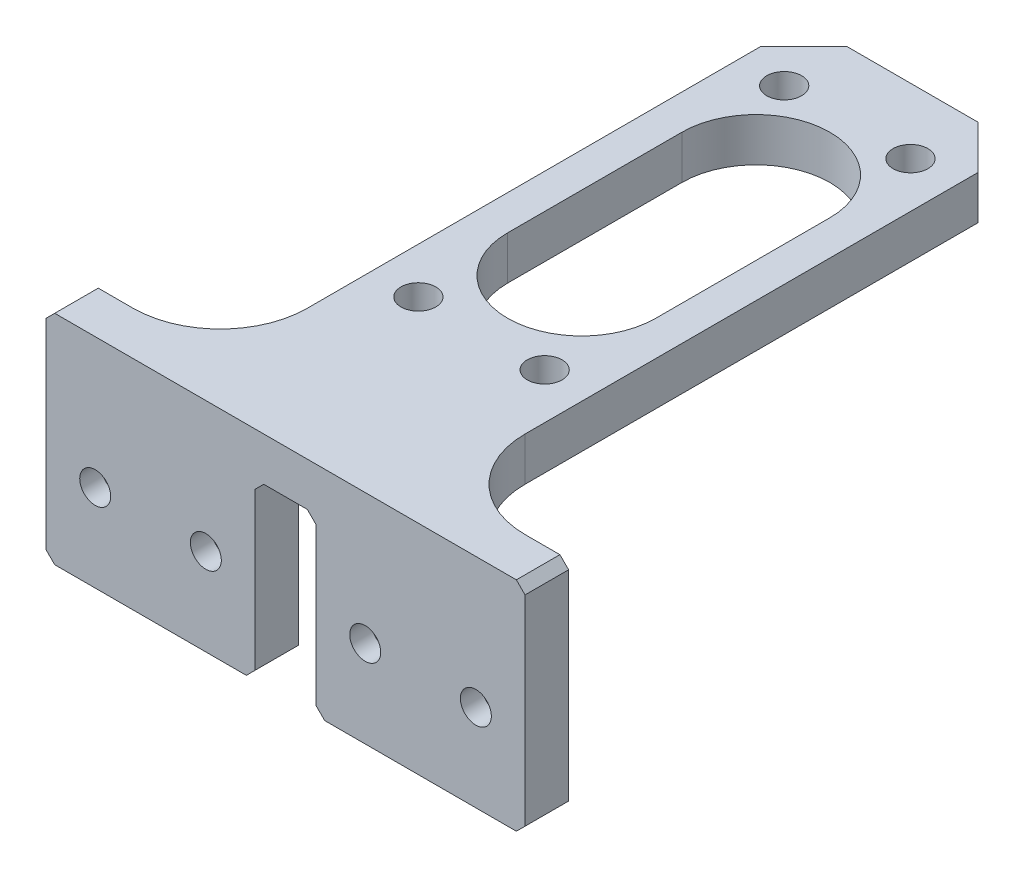
from build123d import *

# Parameters (mm, degrees)
SKETCH1_W           = 25
SKETCH1_H           = 72
SKETCH1_W_2         = 15
SKETCH1_H_2         = 5
BOSS_EXTRUDE1_DEPTH = 5
SKETCH2_R           = 2
CUT_EXTRUDE1_DEPTH  = 46.576858163
CHAMFER1_SIZE       = 5
CUT_EXTRUDE2_DEPTH  = 46.576858163
SKETCH5_W           = 24
SKETCH5_H           = 5
BOSS_EXTRUDE3_DEPTH = 20
FILLET2_R           = 10
CHAMFER3_SIZE       = 1
HOLE1_D             = 3.556
HOLE1_CBORE_D       = 6.858
HOLE1_CBORE_DEPTH   = 2.54
CHAMFER4_SIZE       = 0.5


with BuildPart() as part:
    # Sketch1 → Boss-Extrude1 (new body)
    with BuildSketch(Plane(origin=(0, 0, 0), x_dir=(1, 0, 0), z_dir=(0, 1, 0))):
        Rectangle(SKETCH1_W, SKETCH1_H)
        with Locations((-20, -33.5)):
            Rectangle(SKETCH1_W_2, SKETCH1_H_2)
        with Locations((20, -33.5)):
            Rectangle(SKETCH1_W_2, SKETCH1_H_2)
    extrude(amount=BOSS_EXTRUDE1_DEPTH)

    # Sketch2 → Cut-Extrude1 (cut, through all)
    with BuildSketch(Plane(origin=(0, 5, 0), x_dir=(1, 0, 0), z_dir=(0, 1, 0))):
        with Locations(Location((-7.25, 28.5, 0), (0, 0, 270))):
            Circle(SKETCH2_R)
        with Locations(Location((7.25, 28.5, 0), (0, 0, 270))):
            Circle(SKETCH2_R)
        with Locations(Location((-7.25, -13.5, 0), (0, 0, 270))):
            Circle(SKETCH2_R)
        with Locations(Location((7.25, -13.5, 0), (0, 0, 270))):
            Circle(SKETCH2_R)
    extrude(amount=-CUT_EXTRUDE1_DEPTH, mode=Mode.SUBTRACT)

    # Chamfer1
    chamfer1_edges = [part.edges().sort_by_distance(p)[0] for p in [
        (-12.5, 2.5, -36),
        (12.5, 2.5, -36),
    ]]
    chamfer(chamfer1_edges, length=CHAMFER1_SIZE)

    # Sketch3 → Cut-Extrude2 (cut, through all)
    with BuildSketch(Plane(origin=(0, 5, 0), x_dir=(1, 0, 0), z_dir=(0, 1, 0))):
        with BuildLine():
            Line((-8.5, -2), (-8.5, 18))
            ThreePointArc((-8.5, 18), (0, 26.5), (8.5, 18))
            Line((8.5, 18), (8.5, -2))
            ThreePointArc((8.5, -2), (0, -10.5), (-8.5, -2))
        make_face()
    extrude(amount=-CUT_EXTRUDE2_DEPTH, mode=Mode.SUBTRACT)

    # Sketch5 → Boss-Extrude3 (add)
    with BuildSketch(Plane(origin=(0, 0, 0), x_dir=(-1, 0, 0), z_dir=(0, -1, 0))):
        with Locations((15.5, -33.5)):
            Rectangle(SKETCH5_W, SKETCH5_H)
        with Locations((-15.5, -33.5)):
            Rectangle(SKETCH5_W, SKETCH5_H)
    extrude(amount=BOSS_EXTRUDE3_DEPTH)

    # Fillet2
    fillet2_edges = [part.edges().sort_by_distance(p)[0] for p in [
        (-12.5, 2.5, 31),
        (12.5, 2.5, 31),
    ]]
    fillet(fillet2_edges, radius=FILLET2_R)

    # Chamfer3
    chamfer3_edges = [part.edges().sort_by_distance(p)[0] for p in [
        (27.5, 5, 33.5),
        (-27.5, 5, 33.5),
        (-3.5, 0, 33.5),
        (-27.5, -20, 33.5),
        (-3.5, -20, 33.5),
        (3.5, 0, 33.5),
        (27.5, -20, 33.5),
        (3.5, -20, 33.5),
    ]]
    chamfer(chamfer3_edges, length=CHAMFER3_SIZE)

    # Hole1 (through all)
    with Locations(Plane(origin=(0, 0, 31), x_dir=(-1, 0, 0), z_dir=(0, 0, -1))):
        with Locations((-21.85, -10), (-9.15, -10), (9.15, -10), (21.85, -10)):
            CounterBoreHole(HOLE1_D / 2, HOLE1_CBORE_D / 2, HOLE1_CBORE_DEPTH)

    # Chamfer4
    chamfer4_edges = [part.edges().sort_by_distance(p)[0] for p in [
        (-18.421, -10, 31),
        (-5.721, -10, 31),
        (12.579, -10, 31),
        (25.279, -10, 31),
    ]]
    chamfer(chamfer4_edges, length=CHAMFER4_SIZE)


solid = part.part
